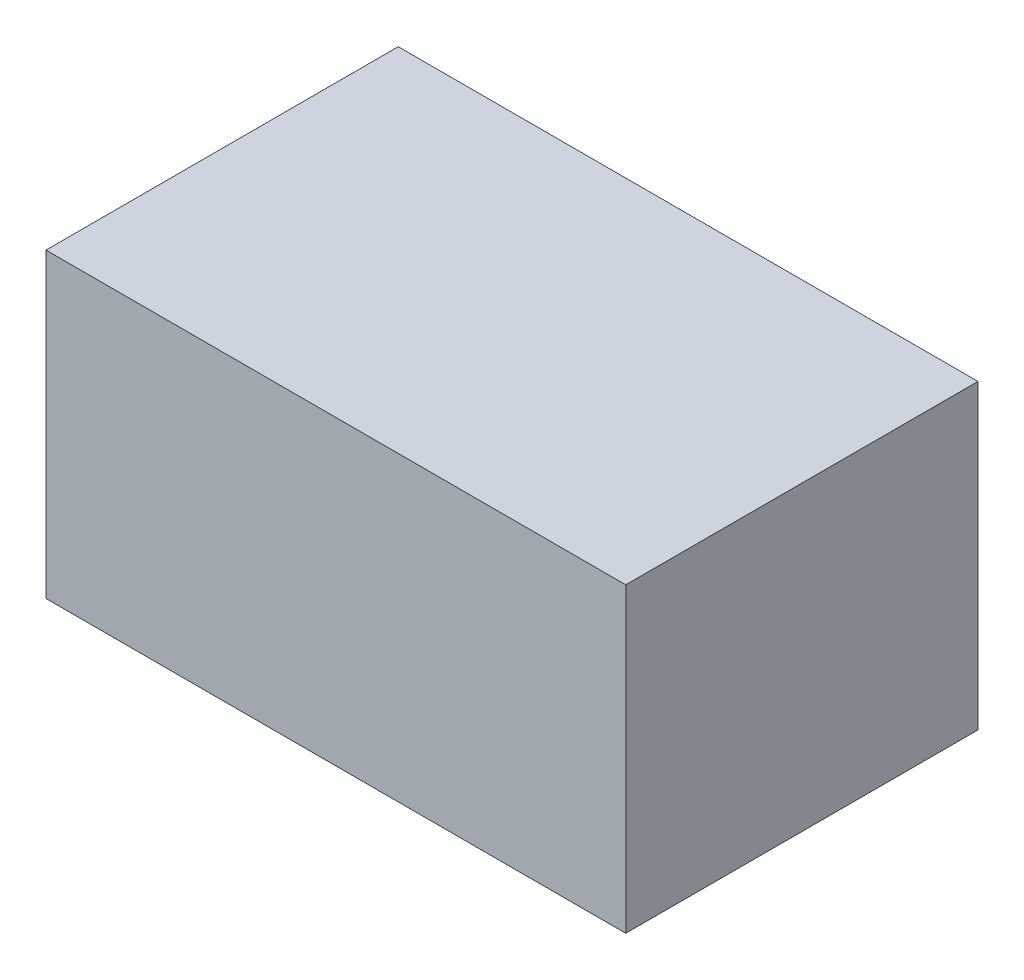
from build123d import *

# Parameters (mm, degrees)
SKETCH1_W           = 41.147295424
SKETCH1_H           = 21.419140084
BOSS_EXTRUDE1_DEPTH = 25
SKETCH2_R           = 7.5
CUT_EXTRUDE1_DEPTH  = 10
SCALE1_SCALE        = 3.5


with BuildPart() as part:
    # Sketch1 → Boss-Extrude1 (new body)
    with BuildSketch(Plane.XY):
        Rectangle(SKETCH1_W, SKETCH1_H)
    extrude(amount=BOSS_EXTRUDE1_DEPTH)

    # Sketch2 → Cut-Extrude1 (cut)
    with BuildSketch(Plane.XZ.offset(10.709570042)):
        with Locations(Location((0, 12.5, 0), (0, 0, 270))):
            Circle(SKETCH2_R)
    extrude(amount=-CUT_EXTRUDE1_DEPTH, mode=Mode.SUBTRACT)


with BuildPart() as part_1:
    # Scale1: scaled about (0, 0.497852103, 12.5)
    add(part.part.scale(SCALE1_SCALE).moved(Location((0, -1.244630257, -31.25))))


solid = part_1.part
